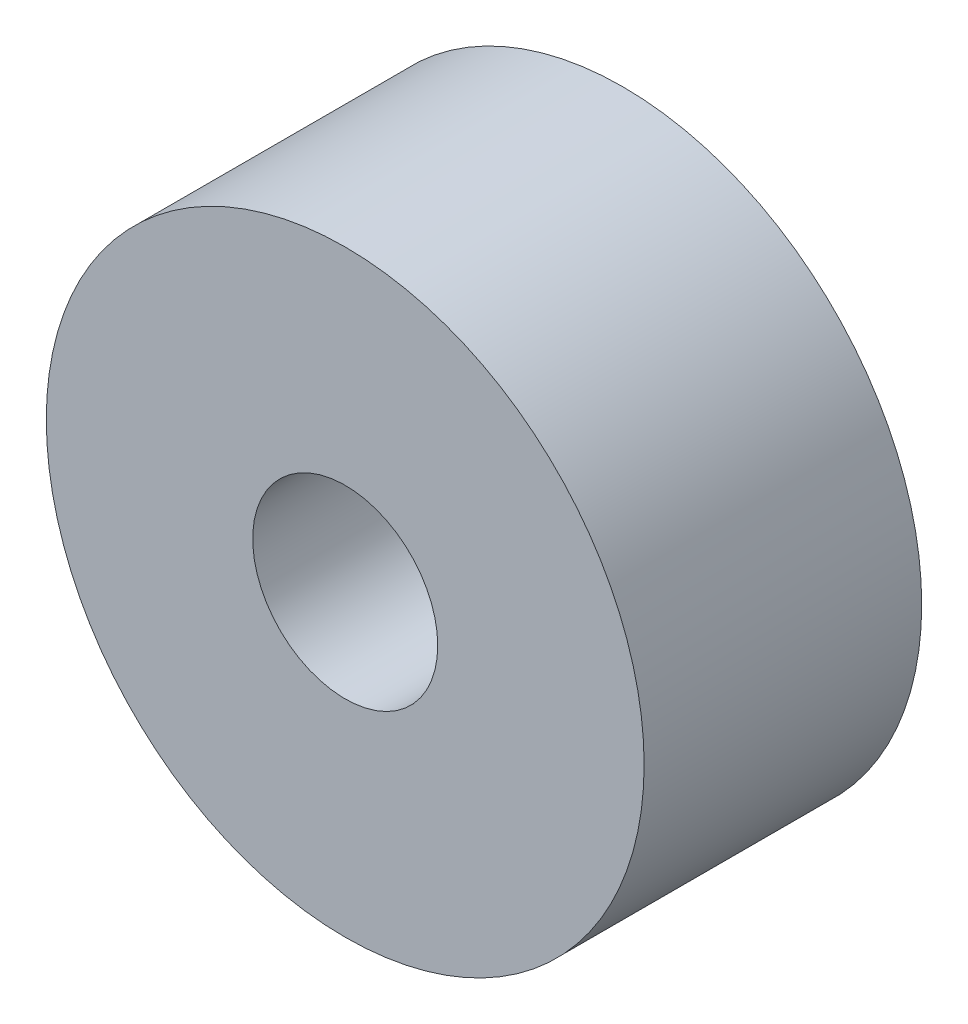
from build123d import *

# Parameters (mm, degrees)
CARRIER_START = -15
SKETCH_1_R    = 32.307692308
SKETCH_1_R_2  = 10
CARRIER_DEPTH = 30


with BuildPart() as part:
    # Эскиз1 → Carrier (new body)
    with BuildSketch(Plane.XY.offset(CARRIER_START)):
        Circle(SKETCH_1_R)
        Circle(SKETCH_1_R_2, mode=Mode.SUBTRACT)
    extrude(amount=CARRIER_DEPTH)


solid = part.part
